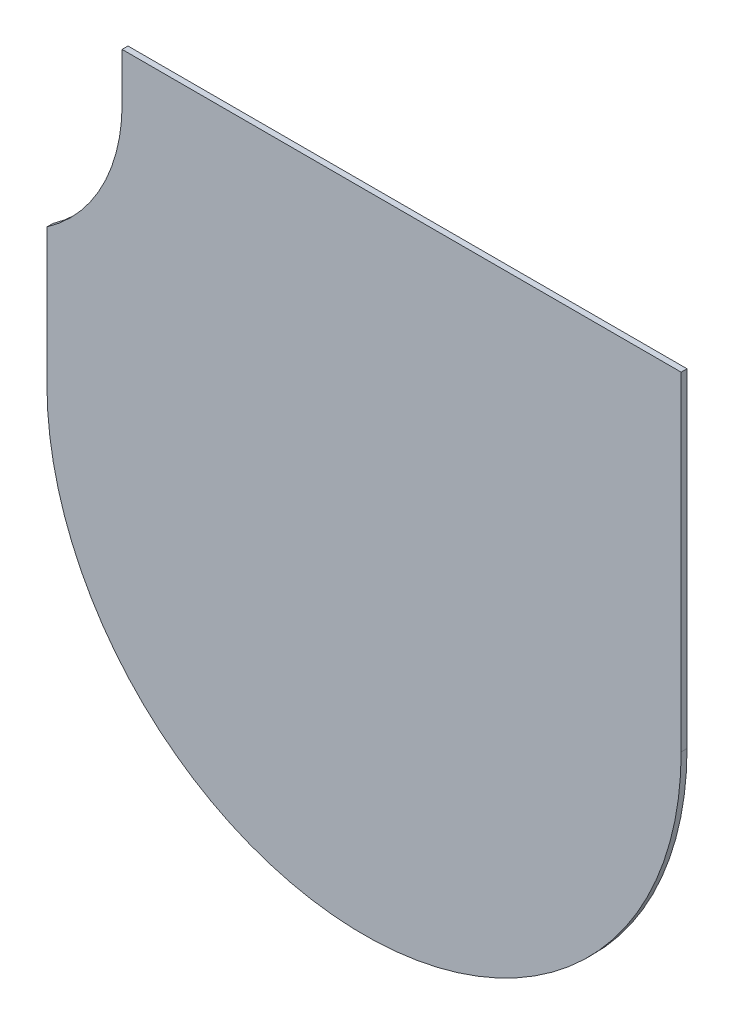
from build123d import *

# Parameters (mm, degrees)
BOSS_EXTRUDE1_DEPTH = 1.5875
BOSS_EXTRUDE2_DEPTH = 1.5875


with BuildPart() as part:
    # Sketch1 → Boss-Extrude1 (new body)
    with BuildSketch(Plane.XY):
        with BuildLine():
            Line((40.005, -76.2), (40.005, -25.840677236))
            ThreePointArc((40.005, -25.840677236), (45.68029526, -13.470384182), (47.625, 0))
            Line((47.625, 0), (47.625, 12.7))
            Line((47.625, 12.7), (186.055, 12.7))
            Line((186.055, 12.7), (186.055, 0))
            Line((186.055, 0), (186.055, -76.2))
            ThreePointArc((186.055, -76.2), (113.03, -149.225), (40.005, -76.2))
        make_face()
    extrude(amount=BOSS_EXTRUDE1_DEPTH)

    # Sketch2 → Boss-Extrude2 (add)
    with BuildSketch(Plane.XY):
        with BuildLine():
            Line((186.055, -76.2), (186.055, 0))
            Line((186.055, 0), (186.055, 12.7))
            Line((186.055, 12.7), (198.755, 12.7))
            Line((198.755, 12.7), (198.755, -76.2))
            ThreePointArc((198.755, -76.2), (113.03, -161.925), (27.305, -76.2))
            Line((27.305, -76.2), (27.305, -39.020220399))
            ThreePointArc((27.305, -39.020220399), (34.294082791, -33.046278315), (40.005, -25.840677236))
            Line((40.005, -25.840677236), (40.005, -76.2))
            ThreePointArc((40.005, -76.2), (113.03, -149.225), (186.055, -76.2))
        make_face()
    extrude(amount=BOSS_EXTRUDE2_DEPTH)


solid = part.part
